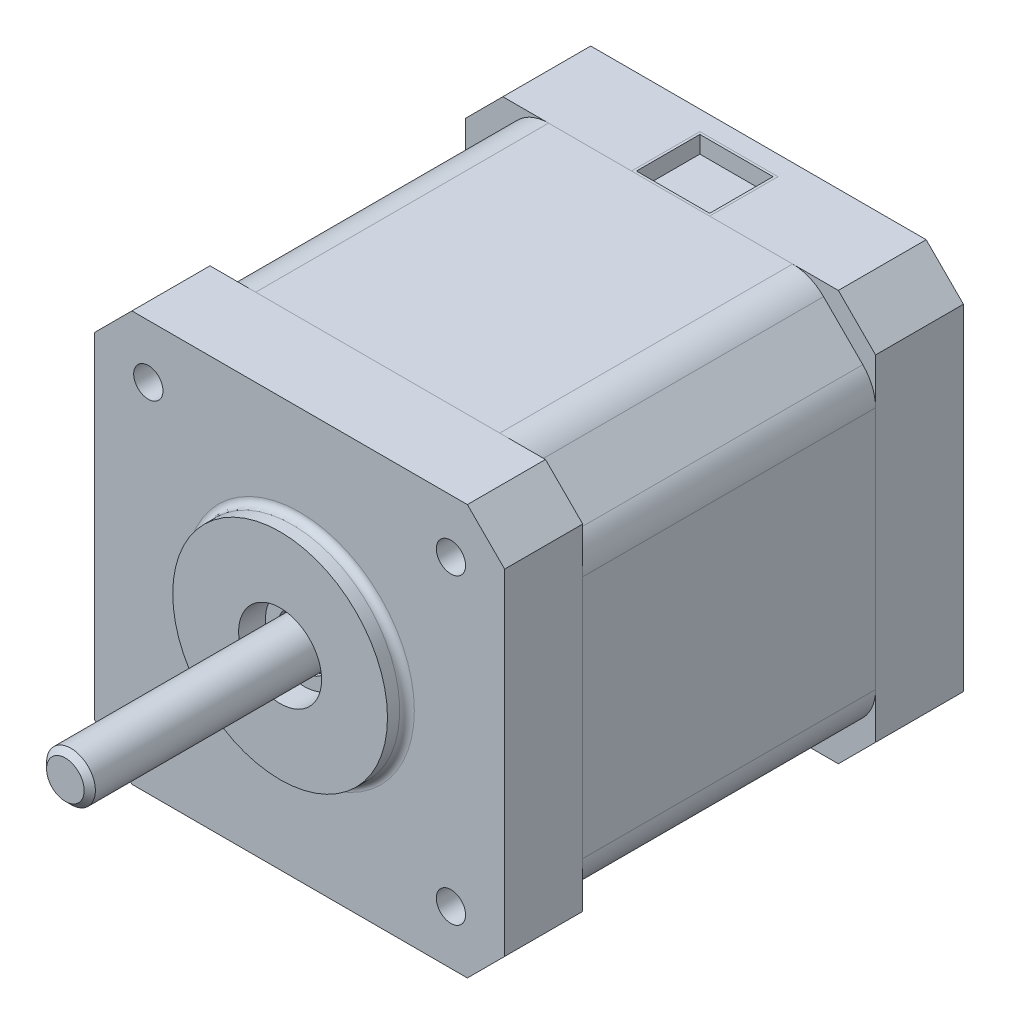
from build123d import *

# Parameters (mm, degrees)
BOSS_EXTRUDE1_DEPTH = 8
BOSS_EXTRUDE2_DEPTH = 30
BOSS_EXTRUDE3_DEPTH = 9
SKETCH5_R           = 1.5
CUT_EXTRUDE1_DEPTH  = 4.5
SKETCH6_R           = 11
BOSS_EXTRUDE4_DEPTH = 2
SKETCH9_R           = 4.25
CUT_EXTRUDE2_DEPTH  = 3
SKETCH8_R           = 2.5
BOSS_EXTRUDE5_DEPTH = 25
SKETCH11_R          = 4
SKETCH11_R_2        = 2.75
BOSS_EXTRUDE6_DEPTH = 0.5
FILLET1_R           = 0.75
SKETCH13_W          = 8
SKETCH13_H          = 7
CUT_EXTRUDE3_DEPTH  = 2
SKETCH14_W          = 8
SKETCH14_H          = 7
BOSS_EXTRUDE7_DEPTH = 0.25
SKETCH15_W          = 8
SKETCH15_H          = 7
SKETCH15_W_2        = 7.5
SKETCH15_H_2        = 6.5
BOSS_EXTRUDE8_DEPTH = 1.75


with BuildPart() as part:
    # Sketch1 → Boss-Extrude1 (new body)
    with BuildSketch(Plane.XY):
        Polygon((17.183766184, 21), (-17.183766184, 21), (-21, 17.183766184), (-21, -17.183766184), (-17.183766184, -21), (17.183766184, -21), (21, -17.183766184), (21, 17.183766184), align=None)
    extrude(amount=-BOSS_EXTRUDE1_DEPTH)

    # Sketch5 → Cut-Extrude1 (cut)
    with BuildSketch(Plane.XY):
        with Locations((-15.5, 15.5)):
            Circle(SKETCH5_R)
        with Locations((15.5, 15.5)):
            Circle(SKETCH5_R)
        with Locations((15.5, -15.5)):
            Circle(SKETCH5_R)
        with Locations((-15.5, -15.5)):
            Circle(SKETCH5_R)
    extrude(amount=-CUT_EXTRUDE1_DEPTH, mode=Mode.SUBTRACT)

    # Sketch6 → Boss-Extrude4 (add)
    with BuildSketch(Plane.XY):
        with Locations(Location((0, 0, 0), (0, 0, 180))):
            Circle(SKETCH6_R)
    extrude(amount=BOSS_EXTRUDE4_DEPTH)

    # Sketch9 → Cut-Extrude2 (cut)
    with BuildSketch(Plane.XY.offset(2)):
        Circle(SKETCH9_R)
    extrude(amount=-CUT_EXTRUDE2_DEPTH, mode=Mode.SUBTRACT)

    # Sketch11 → Boss-Extrude6 (add)
    with BuildSketch(Plane.XY.offset(-1)):
        Circle(SKETCH11_R)
        Circle(SKETCH11_R_2, mode=Mode.SUBTRACT)
    extrude(amount=BOSS_EXTRUDE6_DEPTH)

    # Fillet1
    fillet1_edges = [part.edges().sort_by_distance(p)[0] for p in [
        (11, 0, 0),
    ]]
    fillet(fillet1_edges, radius=FILLET1_R)


with BuildPart() as body_2:
    # Sketch3 → Boss-Extrude2 (new body)
    with BuildSketch(Plane(origin=(0, 0, -8), x_dir=(-1, 0, 0), z_dir=(0, 0, -1))):
        with BuildLine():
            Line((-19.68807717, 15.66726189), (-15.66726189, 19.68807717))
            ThreePointArc((-15.66726189, 19.68807717), (-14.214109783, 20.659042365), (-12.5, 21))
            Line((-12.5, 21), (12.5, 21))
            ThreePointArc((12.5, 21), (14.214109783, 20.659042365), (15.66726189, 19.68807717))
            Line((15.66726189, 19.68807717), (19.68807717, 15.66726189))
            ThreePointArc((19.68807717, 15.66726189), (20.659042365, 14.214109783), (21, 12.5))
            Line((21, 12.5), (21, -12.5))
            ThreePointArc((21, -12.5), (20.659042365, -14.214109783), (19.68807717, -15.66726189))
            Line((19.68807717, -15.66726189), (15.66726189, -19.68807717))
            ThreePointArc((15.66726189, -19.68807717), (14.214109783, -20.659042365), (12.5, -21))
            Line((12.5, -21), (-12.5, -21))
            ThreePointArc((-12.5, -21), (-14.214109783, -20.659042365), (-15.66726189, -19.68807717))
            Line((-15.66726189, -19.68807717), (-19.68807717, -15.66726189))
            ThreePointArc((-19.68807717, -15.66726189), (-20.659042365, -14.214109783), (-21, -12.5))
            Line((-21, -12.5), (-21, 12.5))
            ThreePointArc((-21, 12.5), (-20.659042365, 14.214109783), (-19.68807717, 15.66726189))
        make_face()
    extrude(amount=BOSS_EXTRUDE2_DEPTH)


with BuildPart() as body_3:
    # Sketch4 → Boss-Extrude3 (new body)
    with BuildSketch(Plane(origin=(0, 0, -38), x_dir=(-1, 0, 0), z_dir=(0, 0, -1))):
        Polygon((-17.183766184, 21), (-21, 17.183766184), (-21, -17.183766184), (-17.183766184, -21), (17.183766184, -21), (21, -17.183766184), (21, 17.183766184), (17.183766184, 21), align=None)
    extrude(amount=BOSS_EXTRUDE3_DEPTH)

    # Sketch13 → Cut-Extrude3 (cut)
    with BuildSketch(Plane(origin=(0, 21, 0), x_dir=(1, 0, 0), z_dir=(0, 1, 0))):
        with Locations((0, 41.5)):
            Rectangle(SKETCH13_W, SKETCH13_H)
    extrude(amount=-CUT_EXTRUDE3_DEPTH, mode=Mode.SUBTRACT)


with BuildPart() as body_4:
    # Sketch8 → Boss-Extrude5 (new body)
    with BuildSketch(Plane.XY.offset(-1)):
        Circle(SKETCH8_R)
    extrude(amount=BOSS_EXTRUDE5_DEPTH)

    # Sketch12 → Cut-Revolve1 (revolve, cut)
    with BuildSketch(Plane(origin=(0, 0, 0), x_dir=(0, 0, -1), z_dir=(1, 0, 0)), mode=Mode.PRIVATE) as cut_revolve1_sk:
        Polygon((-24, 1.925), (-23.425, 2.5), (-24, 2.5), align=None)
    revolve(cut_revolve1_sk.sketch.rotate(Axis((0, 0, 24), (0, 0, -1)), 90), axis=Axis((0, 0, 24), (0, 0, -1)), mode=Mode.SUBTRACT)


with BuildPart() as body_5:
    # Sketch14 → Boss-Extrude7 (new body)
    with BuildSketch(Plane(origin=(0, 19, 0), x_dir=(1, 0, 0), z_dir=(0, 1, 0))):
        with Locations((0, 41.5)):
            Rectangle(SKETCH14_W, SKETCH14_H)
    extrude(amount=BOSS_EXTRUDE7_DEPTH)

    # Sketch15 → Boss-Extrude8 (add)
    with BuildSketch(Plane(origin=(0, 19.25, 0), x_dir=(1, 0, 0), z_dir=(0, 1, 0))):
        with Locations((0, 41.5)):
            Rectangle(SKETCH15_W, SKETCH15_H)
        with Locations((0, 41.5)):
            Rectangle(SKETCH15_W_2, SKETCH15_H_2, mode=Mode.SUBTRACT)
    extrude(amount=BOSS_EXTRUDE8_DEPTH)


solid = Compound([part.part, body_2.part, body_3.part, body_4.part, body_5.part])
